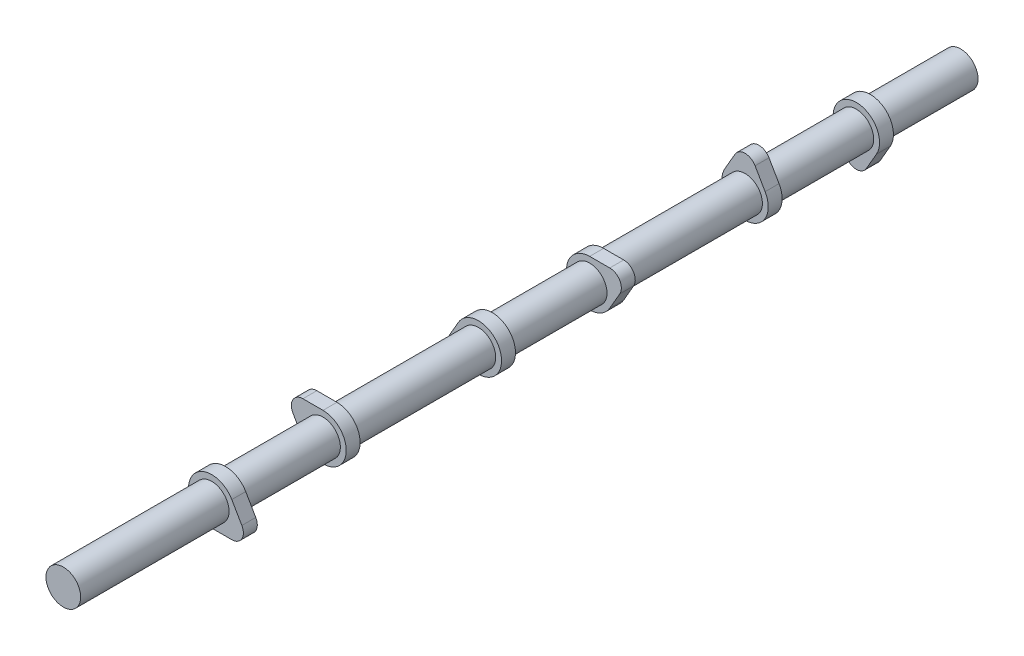
from build123d import *

# Parameters (mm, degrees)
BOSS_EXTRUDE1_DEPTH   = 3.81
BODY_MOVE_COPY2_ANGLE = 180
BOSS_EXTRUDE2_START   = -25.4
SKETCH2_R             = 9.5
BOSS_EXTRUDE2_DEPTH   = 146.05
LPATTERN1_COUNT       = 3
LPATTERN1_PITCH       = 146.05
BODY_MOVE_COPY3_ANGLE = 120
BODY_MOVE_COPY4_ANGLE = 120
BOSS_EXTRUDE3_START   = 27.94
SKETCH3_R             = 9.5
BOSS_EXTRUDE3_DEPTH   = 27.94
SKETCH5_R             = 9.5
BOSS_EXTRUDE4_DEPTH   = 25.4


with BuildPart() as part:
    # Sketch1 → Boss-Extrude1 (new, symmetric)
    with BuildSketch(Plane.XY):
        with BuildLine():
            Line((-5.499261314, 15.875), (-10.998522628, 6.35))
            ThreePointArc((-10.998522628, 6.35), (0, -12.7), (10.998522628, 6.35))
            Line((10.998522628, 6.35), (5.499261314, 15.875))
            ThreePointArc((5.499261314, 15.875), (0, 19.05), (-5.499261314, 15.875))
        make_face()
    extrude(amount=BOSS_EXTRUDE1_DEPTH, both=True)


with BuildPart() as body_2:
    # Body-Move/Copy1: copy of part
    add(part.part.moved(Location((0, 0, 60.96))))


with BuildPart() as part_1:
    # Body-Move/Copy2: moved
    add(part.part.rotate(Axis((0, 0, 0), (0, 0, 1)), BODY_MOVE_COPY2_ANGLE))


    add(body_2.part)  # Boss-Extrude2 merges body 2
    # Sketch2 → Boss-Extrude2 (add)
    with BuildSketch(Plane.XY.offset(BOSS_EXTRUDE2_START)):
        Circle(SKETCH2_R)
    extrude(amount=BOSS_EXTRUDE2_DEPTH)


with BuildPart() as lpattern1_1:
    # LPattern1: pattern copy
    add(part_1.part.moved(Location(Vector(0, 0, 1) * (1 * LPATTERN1_PITCH))))


with BuildPart() as lpattern1_2:
    # LPattern1: pattern copy
    add(part_1.part.moved(Location(Vector(0, 0, 1) * (2 * LPATTERN1_PITCH))))


with BuildPart() as lpattern1_1_1:
    # Body-Move/Copy3: moved
    add(lpattern1_1.part.rotate(Axis((0, 0, 0), (0, 0, 1)), BODY_MOVE_COPY3_ANGLE))


with BuildPart() as lpattern1_2_1:
    # Body-Move/Copy4: moved
    add(lpattern1_2.part.rotate(Axis((0, 0, 0), (0, 0, -1)), BODY_MOVE_COPY4_ANGLE))


with BuildPart() as part_2:
    add(part_1.part)

    # Sketch3 → Boss-Extrude3 (add)
    with BuildSketch(Plane(origin=(0, 0, -25.4), x_dir=(-1, 0, 0), z_dir=(0, 0, -1)).offset(BOSS_EXTRUDE3_START)):
        Circle(SKETCH3_R)
    extrude(amount=-BOSS_EXTRUDE3_DEPTH)

    # Combine1: union LPattern1_1, LPattern1_2
    add(lpattern1_1_1.part)
    add(lpattern1_2_1.part)

    # Sketch5 → Boss-Extrude4 (add)
    with BuildSketch(Plane.XY.offset(412.75)):
        Circle(SKETCH5_R)
    extrude(amount=BOSS_EXTRUDE4_DEPTH)


solid = part_2.part
